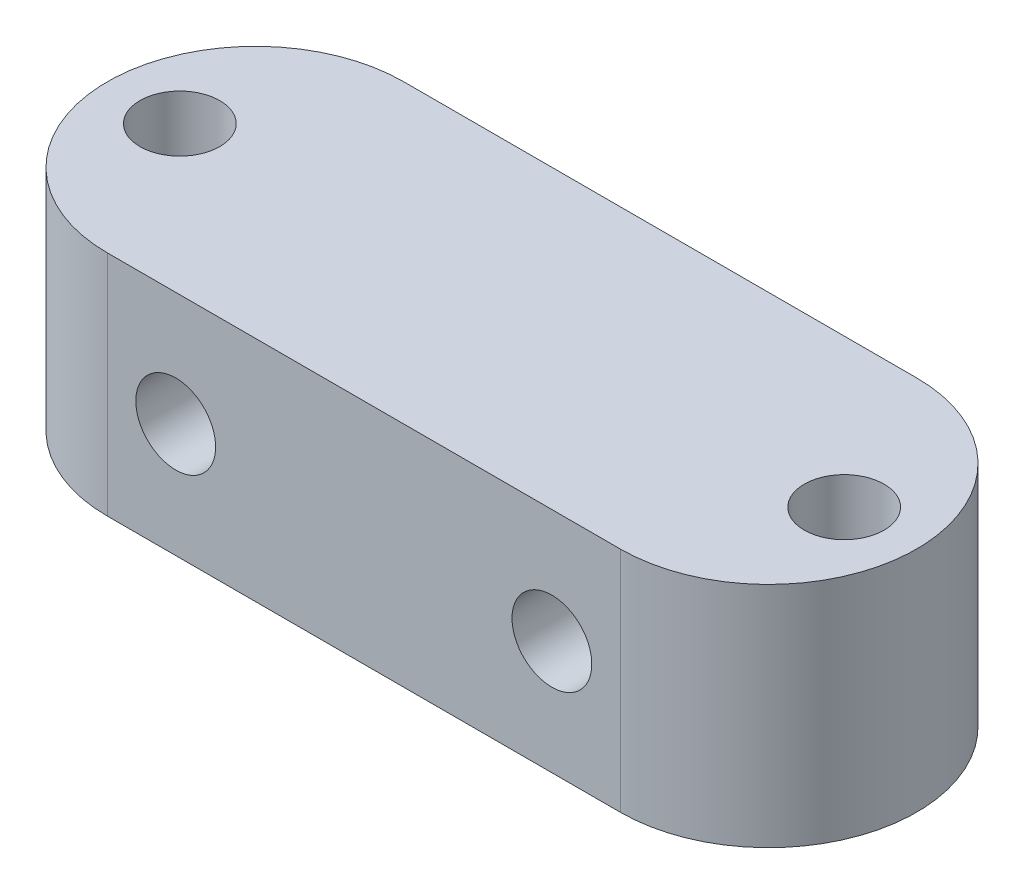
from build123d import *

# Parameters (mm, degrees)
SKETCH_1_R          = 1.75
EXTRUDE_1_DEPTH     = 10
SKETCH_2_R          = 1.75
CUT_EXTRUDE_1_DEPTH = 21


with BuildPart() as part:
    # 草图1 → 凸台-拉伸1 (new body)
    with BuildSketch(Plane(origin=(0, 0, 0), x_dir=(1, 0, 0), z_dir=(0, 1, 0))):
        with BuildLine():
            Line((-102.099280991, 5.948332783), (-79.599280991, 5.948332783))
            ThreePointArc((-79.599280991, 5.948332783), (-73.099280991, -0.551667217), (-79.599280991, -7.051667217))
            Line((-79.599280991, -7.051667217), (-102.099280991, -7.051667217))
            ThreePointArc((-102.099280991, -7.051667217), (-108.599280991, -0.551667217), (-102.099280991, 5.948332783))
        make_face()
        with Locations(Location((-105.419280991, -0.551667217, 0), (0, 0, 270))):
            Circle(SKETCH_1_R, mode=Mode.SUBTRACT)
        with Locations(Location((-76.279280991, -0.551667217, 0), (0, 0, 270))):
            Circle(SKETCH_1_R, mode=Mode.SUBTRACT)
    extrude(amount=EXTRUDE_1_DEPTH)

    # 草图2 → 切除-拉伸1 (cut)
    with BuildSketch(Plane(origin=(0, 0, -5.948332783), x_dir=(-1, 0, 0), z_dir=(0, 0, -1))):
        with Locations((99.099280991, 5)):
            Circle(SKETCH_2_R)
        with Locations((82.599280991, 5)):
            Circle(SKETCH_2_R)
    extrude(amount=-CUT_EXTRUDE_1_DEPTH, mode=Mode.SUBTRACT)


solid = part.part
